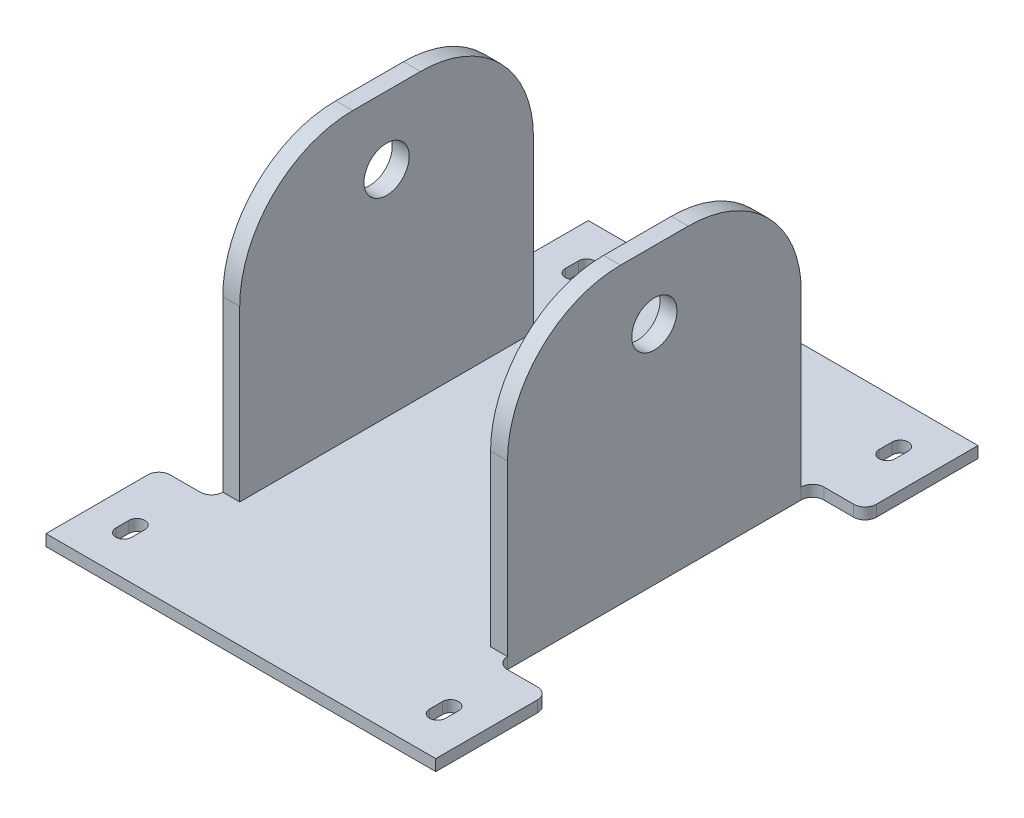
from build123d import *

# Parameters (mm, degrees)
BOSS_EXTRUDE1_DEPTH = 2
SKETCH2_W           = 3
SKETCH2_H           = 52
BOSS_EXTRUDE2_DEPTH = 50
SKETCH3_R           = 4
CUT_EXTRUDE1_DEPTH  = 90


with BuildPart() as part:
    # Sketch1 → Boss-Extrude1 (new body)
    with BuildSketch(Plane(origin=(0, 0, 0), x_dir=(1, 0, 0), z_dir=(0, 1, 0))):
        with BuildLine():
            Line((-32.5, 28), (-27.204017471, 28))
            ThreePointArc((-27.204017471, 28), (-25.789803909, 27.414213562), (-25.204017471, 26))
            Line((-25.204017471, 26), (-25.204017471, -26))
            ThreePointArc((-25.204017471, -26), (-25.789803909, -27.414213562), (-27.204017471, -28))
            Line((-27.204017471, -28), (-32.5, -28))
            ThreePointArc((-32.5, -28), (-33.914213562, -28.585786438), (-34.5, -30))
            Line((-34.5, -30), (-34.5, -48))
            Line((-34.5, -48), (34.5, -48))
            Line((34.5, -48), (34.5, -30))
            ThreePointArc((34.5, -30), (33.914213562, -28.585786438), (32.5, -28))
            Line((32.5, -28), (27.204017471, -28))
            ThreePointArc((27.204017471, -28), (25.789803909, -27.414213562), (25.204017471, -26))
            Line((25.204017471, -26), (25.204017471, 26))
            ThreePointArc((25.204017471, 26), (25.789803909, 27.414213562), (27.204017471, 28))
            Line((27.204017471, 28), (32.5, 28))
            ThreePointArc((32.5, 28), (33.914213562, 28.585786438), (34.5, 30))
            Line((34.5, 30), (34.5, 48))
            Line((34.5, 48), (-34.5, 48))
            Line((-34.5, 48), (-34.5, 30))
            ThreePointArc((-34.5, 30), (-33.914213562, 28.585786438), (-32.5, 28))
        make_face()
        with BuildLine():
            Line((-26.353730012, 40.955917197), (-26.353730012, 38.634748977))
            ThreePointArc((-26.353730012, 38.634748977), (-27.768725827, 37.219753162), (-29.183721642, 38.634748977))
            Line((-29.183721642, 38.634748977), (-29.183721642, 40.955917197))
            ThreePointArc((-29.183721642, 40.955917197), (-27.768725827, 42.370913012), (-26.353730012, 40.955917197))
        make_face(mode=Mode.SUBTRACT)
        with BuildLine():
            Line((26.353730012, 40.955917197), (26.353730012, 38.634748977))
            ThreePointArc((26.353730012, 38.634748977), (27.768725827, 37.219753162), (29.183721642, 38.634748977))
            Line((29.183721642, 38.634748977), (29.183721642, 40.955917197))
            ThreePointArc((29.183721642, 40.955917197), (27.768725827, 42.370913012), (26.353730012, 40.955917197))
        make_face(mode=Mode.SUBTRACT)
        with BuildLine():
            Line((-26.353730012, -40.955917197), (-26.353730012, -38.634748977))
            ThreePointArc((-26.353730012, -38.634748977), (-27.768725827, -37.219753162), (-29.183721642, -38.634748977))
            Line((-29.183721642, -38.634748977), (-29.183721642, -40.955917197))
            ThreePointArc((-29.183721642, -40.955917197), (-27.768725827, -42.370913012), (-26.353730012, -40.955917197))
        make_face(mode=Mode.SUBTRACT)
        with BuildLine():
            Line((26.353730012, -40.955917197), (26.353730012, -38.634748977))
            ThreePointArc((26.353730012, -38.634748977), (27.768725827, -37.219753162), (29.183721642, -38.634748977))
            Line((29.183721642, -38.634748977), (29.183721642, -40.955917197))
            ThreePointArc((29.183721642, -40.955917197), (27.768725827, -42.370913012), (26.353730012, -40.955917197))
        make_face(mode=Mode.SUBTRACT)
    extrude(amount=BOSS_EXTRUDE1_DEPTH)

    # Sketch2 → Boss-Extrude2 (add)
    with BuildSketch(Plane(origin=(0, 2, 0), x_dir=(1, 0, 0), z_dir=(0, 1, 0))):
        with Locations((-23.704017471, 0)):
            Rectangle(SKETCH2_W, SKETCH2_H)
        with Locations((23.704017471, 0)):
            Rectangle(SKETCH2_W, SKETCH2_H)
    extrude(amount=BOSS_EXTRUDE2_DEPTH)

    # Sketch3 → Cut-Extrude1 (cut)
    with BuildSketch(Plane.ZY.offset(25.204017471)):
        with BuildLine():
            Line((-26, 52), (-26, 32))
            ThreePointArc((-26, 32), (-20.142135624, 46.142135624), (-6, 52))
            Line((-6, 52), (-26, 52))
        make_face()
        with BuildLine():
            ThreePointArc((6, 52), (20.142135624, 46.142135624), (26, 32))
            Line((26, 32), (26, 52))
            Line((26, 52), (6, 52))
        make_face()
        with Locations((0, 40)):
            Circle(SKETCH3_R)
    extrude(amount=-CUT_EXTRUDE1_DEPTH, mode=Mode.SUBTRACT)


solid = part.part
